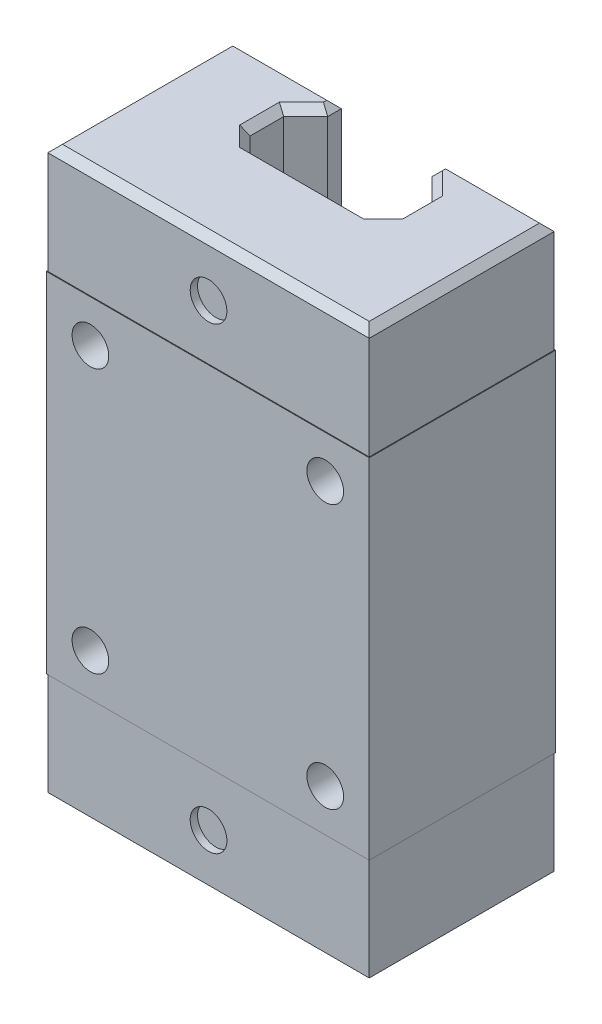
from build123d import *

# Parameters (mm, degrees)
SKETCH_1_W          = 44
SKETCH_1_H          = 25.4
EXTRUDE_1_DEPTH     = 77.5
CUT_EXTRUDE_1_DEPTH = 82.556973951
SKETCH_3_R          = 2.5
CUT_EXTRUDE_2_DEPTH = 6
CUT_EXTRUDE_3_DEPTH = 15
SKETCH_5_R          = 2.5
CUT_EXTRUDE_4_DEPTH = 1
CHAMFER_1_SIZE      = 1


with BuildPart() as part:
    # 草图1 → 凸台-拉伸1 (new body)
    with BuildSketch(Plane(origin=(0, 0, 0), x_dir=(1, 0, 0), z_dir=(0, 1, 0))):
        Rectangle(SKETCH_1_W, SKETCH_1_H)
    extrude(amount=EXTRUDE_1_DEPTH)

    # 草图2 → 切除-拉伸1 (cut, through all)
    with BuildSketch(Plane.XZ):
        Polygon((8, -1.2), (-8, -1.2), (-10, -3.2), (-10, -7.7), (-7, -10.7), (-7, -12.7), (7, -12.7), (7, -10.7), (10, -7.7), (10, -3.2), align=None)
    extrude(amount=-CUT_EXTRUDE_1_DEPTH, mode=Mode.SUBTRACT)

    # 草图3 → 切除-拉伸2 (cut)
    with BuildSketch(Plane.XY.offset(12.7)):
        with Locations((-16, 20.75)):
            Circle(SKETCH_3_R)
        with Locations((-16, 56.75)):
            Circle(SKETCH_3_R)
        with Locations(Location((16, 56.75, 0), (0, 0, 180))):
            Circle(SKETCH_3_R)
        with Locations(Location((16, 20.75, 0), (0, 0, 180))):
            Circle(SKETCH_3_R)
    extrude(amount=-CUT_EXTRUDE_2_DEPTH, mode=Mode.SUBTRACT)

    # 草图4 → 切除-拉伸3 (cut)
    with BuildSketch(Plane(origin=(0, 77.5, 0), x_dir=(1, 0, 0), z_dir=(0, 1, 0))):
        Polygon((22, -12.7), (22, 12.7), (7, 12.7), (7, 10.7), (10, 7.7), (10, 3.2), (8, 1.2), (-8, 1.2), (-10, 3.2), (-10, 7.7), (-7, 10.7), (-7, 12.7), (-22, 12.7), (-22, -12.7), align=None)
        Polygon((21.9, -12.6), (21.9, 12.6), (7.1, 12.6), (7.1, 10.741421356), (10.1, 7.741421356), (10.1, 3.158578644), (8.041421356, 1.1), (-8.041421356, 1.1), (-10.1, 3.158578644), (-10.1, 7.741421356), (-7.1, 10.741421356), (-7.1, 12.6), (-21.9, 12.6), (-21.9, -12.6), align=None, mode=Mode.SUBTRACT)
    cut_extrude_3 = extrude(amount=-CUT_EXTRUDE_3_DEPTH, mode=Mode.SUBTRACT)

    # 镜向1: 切除-拉伸3 across plane
    add(cut_extrude_3.mirror(Plane.ZX.offset(38.75)), mode=Mode.SUBTRACT)

    # 草图5 → 切除-拉伸4 (cut)
    with BuildSketch(Plane.XY.offset(12.6)):
        with Locations((0, 7.5)):
            Circle(SKETCH_5_R)
        with Locations(Location((0, 70, 0), (0, 0, 180))):
            Circle(SKETCH_5_R)
    extrude(amount=-CUT_EXTRUDE_4_DEPTH, mode=Mode.SUBTRACT)

    # 倒角1
    chamfer_1_edges = [part.edges().sort_by_distance(p)[0] for p in [
        (21.9, 0, 0),
        (14.5, 0, -12.6),
        (7.1, 0, -11.670710678),
        (8.6, 0, -9.241421356),
        (10.1, 0, -5.45),
        (9.070710678, 0, -2.129289322),
        (0, 0, -1.1),
        (-9.070710678, 0, -2.129289322),
        (-10.1, 0, -5.45),
        (-8.6, 0, -9.241421356),
        (-7.1, 0, -11.670710678),
        (-14.5, 0, -12.6),
        (-21.9, 0, 0),
        (0, 0, 12.6),
        (21.9, 77.5, 0),
        (14.5, 77.5, -12.6),
        (7.1, 77.5, -11.670710678),
        (8.6, 77.5, -9.241421356),
        (10.1, 77.5, -5.45),
        (9.070710678, 77.5, -2.129289322),
        (0, 77.5, -1.1),
        (-9.070710678, 77.5, -2.129289322),
        (-10.1, 77.5, -5.45),
        (-8.6, 77.5, -9.241421356),
        (-7.1, 77.5, -11.670710678),
        (-14.5, 77.5, -12.6),
        (-21.9, 77.5, 0),
        (0, 77.5, 12.6),
    ]]
    chamfer(chamfer_1_edges, length=CHAMFER_1_SIZE)


solid = part.part
